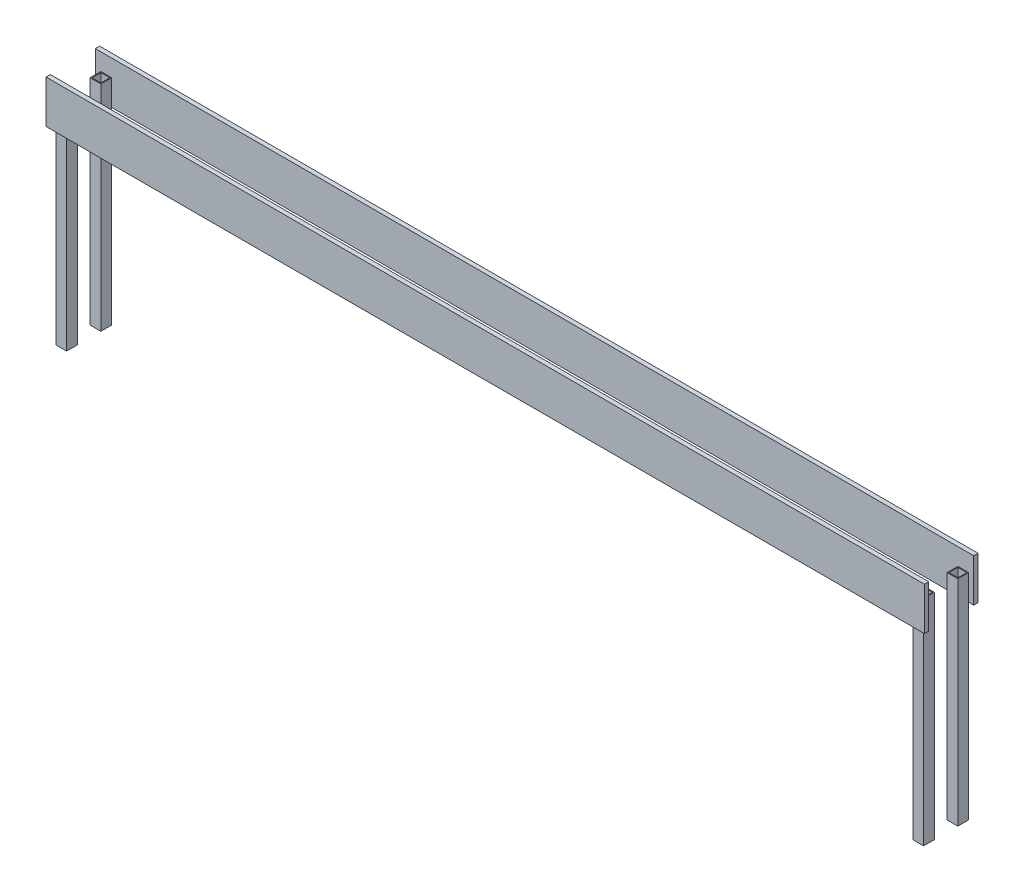
from build123d import *

# Parameters (mm, degrees)
SKIZZE2_W                         = 50
SKIZZE2_H                         = 50
SKIZZE2_W_2                       = 42
SKIZZE2_H_2                       = 42
AUFSATZ_LINEAR_AUSTRAGEN1_DEPTH   = 1000
AUFSATZ_LINEAR_AUSTRAGEN1_2_DEPTH = 1000
AUFSATZ_LINEAR_AUSTRAGEN1_3_DEPTH = 1000
AUFSATZ_LINEAR_AUSTRAGEN1_4_DEPTH = 1000
SKIZZE3_W                         = 4100
SKIZZE3_H                         = 200
AUFSATZ_LINEAR_AUSTRAGEN2_DEPTH   = 20
SKIZZE4_W                         = 4100
SKIZZE4_H                         = 200
AUFSATZ_LINEAR_AUSTRAGEN3_DEPTH   = 20


with BuildPart() as part:
    # Skizze2 → Aufsatz-Linear austragen1 (new body)
    with BuildSketch(Plane(origin=(0, 0, 0), x_dir=(1, 0, 0), z_dir=(0, 1, 0))):
        with Locations((-2000, 80)):
            Rectangle(SKIZZE2_W, SKIZZE2_H)
        with Locations((-2000, 80)):
            Rectangle(SKIZZE2_W_2, SKIZZE2_H_2, mode=Mode.SUBTRACT)
    extrude(amount=AUFSATZ_LINEAR_AUSTRAGEN1_DEPTH)



with BuildPart() as body_2:
    # Skizze2 → Aufsatz-Linear austragen1 2 (new body)
    with BuildSketch(Plane(origin=(0, 0, 0), x_dir=(1, 0, 0), z_dir=(0, 1, 0))):
        with Locations((-2000, -80)):
            Rectangle(SKIZZE2_W, SKIZZE2_H)
        with Locations((-2000, -80)):
            Rectangle(SKIZZE2_W_2, SKIZZE2_H_2, mode=Mode.SUBTRACT)
    extrude(amount=AUFSATZ_LINEAR_AUSTRAGEN1_2_DEPTH)



with BuildPart() as body_3:
    # Skizze2 → Aufsatz-Linear austragen1 3 (new body)
    with BuildSketch(Plane(origin=(0, 0, 0), x_dir=(1, 0, 0), z_dir=(0, 1, 0))):
        with Locations((2000, -80)):
            Rectangle(SKIZZE2_W, SKIZZE2_H)
        with Locations((2000, -80)):
            Rectangle(SKIZZE2_W_2, SKIZZE2_H_2, mode=Mode.SUBTRACT)
    extrude(amount=AUFSATZ_LINEAR_AUSTRAGEN1_3_DEPTH)


with BuildPart() as body_4:
    # Skizze2 → Aufsatz-Linear austragen1 4 (new body)
    with BuildSketch(Plane(origin=(0, 0, 0), x_dir=(1, 0, 0), z_dir=(0, 1, 0))):
        with Locations((2000, 80)):
            Rectangle(SKIZZE2_W, SKIZZE2_H)
        with Locations((2000, 80)):
            Rectangle(SKIZZE2_W_2, SKIZZE2_H_2, mode=Mode.SUBTRACT)
    extrude(amount=AUFSATZ_LINEAR_AUSTRAGEN1_4_DEPTH)


with BuildPart() as body_2_1:
    add(body_2.part)

    add(body_3.part)  # Aufsatz-Linear austragen2 merges body 3
    # Skizze3 → Aufsatz-Linear austragen2 (add)
    with BuildSketch(Plane.XY.offset(105)):
        with Locations((-1, 980)):
            Rectangle(SKIZZE3_W, SKIZZE3_H)
    extrude(amount=AUFSATZ_LINEAR_AUSTRAGEN2_DEPTH)


with BuildPart() as part_1:
    add(part.part)

    add(body_4.part)  # Aufsatz-Linear austragen3 merges body 4
    # Skizze4 → Aufsatz-Linear austragen3 (add)
    with BuildSketch(Plane.XY.offset(-105)):
        with Locations((-1, 980)):
            Rectangle(SKIZZE4_W, SKIZZE4_H)
    extrude(amount=-AUFSATZ_LINEAR_AUSTRAGEN3_DEPTH)


solid = Compound([body_2_1.part, part_1.part])
